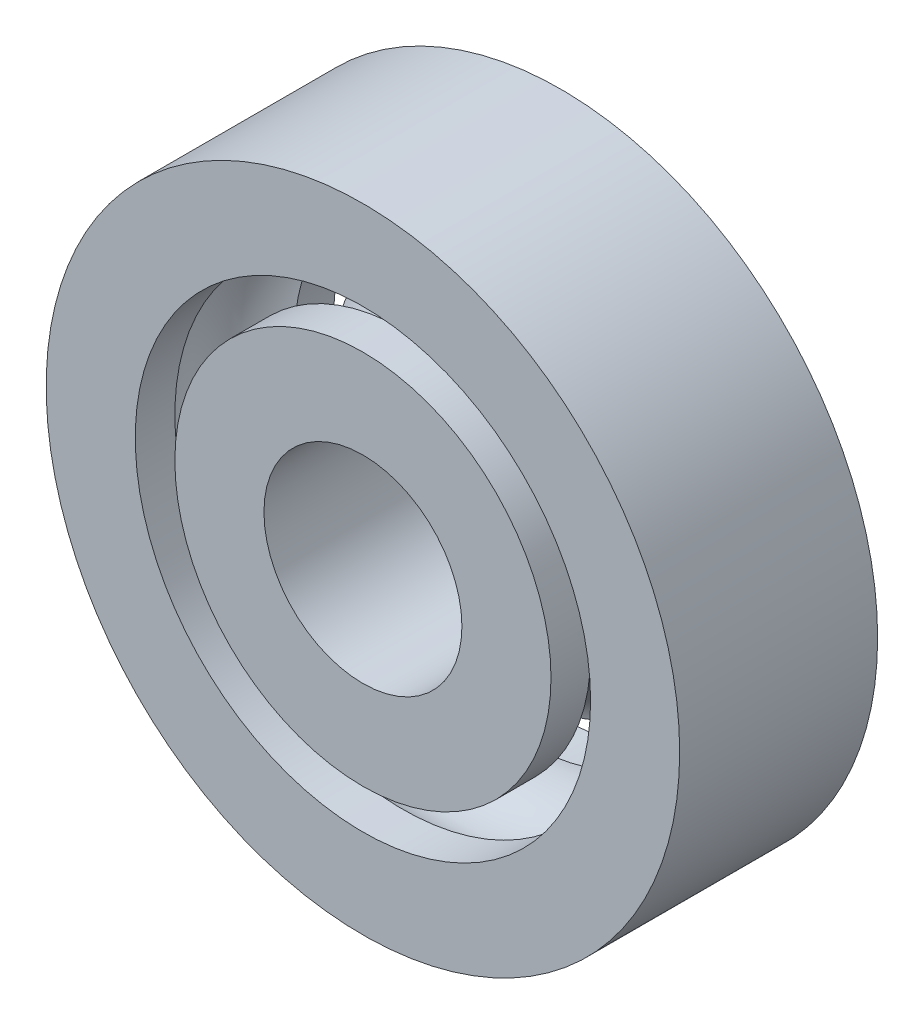
from build123d import *


with BuildPart() as part:
    # Sketch3 → Revolve1 (revolve)
    with BuildSketch(Plane(origin=(0, 0, 0), x_dir=(0, 0, -1), z_dir=(1, 0, 0)), mode=Mode.PRIVATE) as revolve1_sk:
        with BuildLine():
            ThreePointArc((-1.5, 4.75), (0, 3.66886117), (1.5, 4.75))
            Line((1.5, 4.75), (2.5, 4.75))
            Line((2.5, 4.75), (2.5, 2.5))
            Line((2.5, 2.5), (-2.5, 2.5))
            Line((-2.5, 2.5), (-2.5, 4.75))
            Line((-2.5, 4.75), (-1.5, 4.75))
        make_face()
        with BuildLine():
            Line((-2.5, 5.75), (-1.5, 5.75))
            ThreePointArc((-1.5, 5.75), (0, 6.83113883), (1.5, 5.75))
            Line((1.5, 5.75), (2.5, 5.75))
            Line((2.5, 5.75), (2.5, 8))
            Line((2.5, 8), (-2.5, 8))
            Line((-2.5, 8), (-2.5, 5.75))
        make_face()
    revolve(revolve1_sk.sketch.rotate(Axis((0, 0, 2.5), (0, 0, -1)), 90), axis=Axis((0, 0, 2.5), (0, 0, -1)))


solid = part.part
